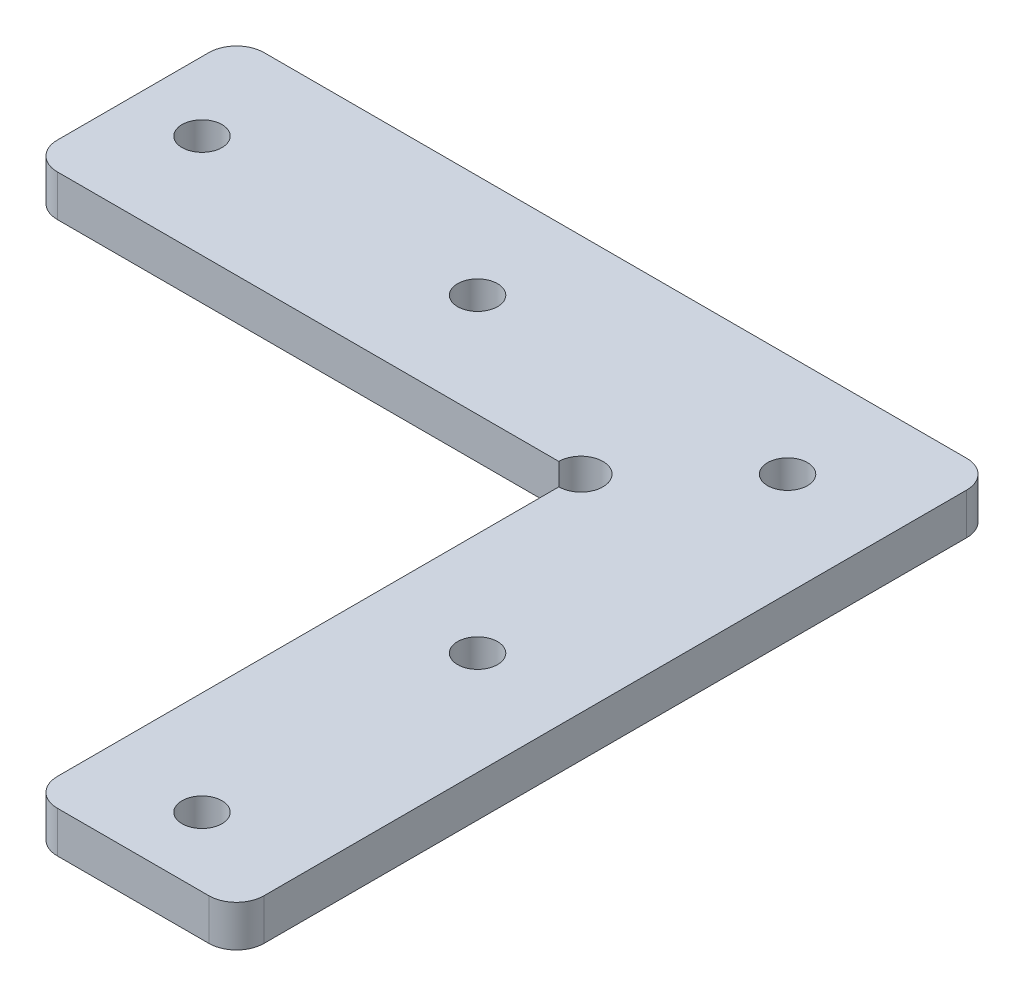
from build123d import *

# Parameters (mm, degrees)
SKETCH_1_R          = 1.45
EXTRUDE_1_DEPTH     = 3
FILLET_1_R          = 2
SKETCH_2_R          = 1.6
CUT_EXTRUDE_1_DEPTH = 78.839578622


with BuildPart() as part:
    # 草图1 → 凸台-拉伸1 (new body)
    with BuildSketch(Plane(origin=(0, 0, 0), x_dir=(1, 0, 0), z_dir=(0, 1, 0))):
        Polygon((-55, 0), (0, 0), (0, -55), (-15, -55), (-15, -15), (-55, -15), align=None)
        with Locations(Location((-7.5, -7.5, 0), (0, 0, 270))):
            Circle(SKETCH_1_R, mode=Mode.SUBTRACT)
        with Locations(Location((-7.5, -30, 0), (0, 0, 270))):
            Circle(SKETCH_1_R, mode=Mode.SUBTRACT)
        with Locations(Location((-7.5, -50, 0), (0, 0, 270))):
            Circle(SKETCH_1_R, mode=Mode.SUBTRACT)
        with Locations(Location((-30, -7.5, 0), (0, 0, 270))):
            Circle(SKETCH_1_R, mode=Mode.SUBTRACT)
        with Locations(Location((-50, -7.5, 0), (0, 0, 270))):
            Circle(SKETCH_1_R, mode=Mode.SUBTRACT)
    extrude(amount=EXTRUDE_1_DEPTH)

    # 圆角1
    fillet_1_edges = [part.edges().sort_by_distance(p)[0] for p in [
        (-55, 1.5, 0),
        (0, 1.5, 0),
        (0, 1.5, 55),
        (-15, 1.5, 55),
        (-55, 1.5, 15),
    ]]
    fillet(fillet_1_edges, radius=FILLET_1_R)

    # 草图2 → 切除-拉伸1 (cut, through all)
    with BuildSketch(Plane(origin=(0, 3, 0), x_dir=(1, 0, 0), z_dir=(0, 1, 0))):
        with Locations((-15, -15)):
            Circle(SKETCH_2_R)
    extrude(amount=-CUT_EXTRUDE_1_DEPTH, mode=Mode.SUBTRACT)


solid = part.part
